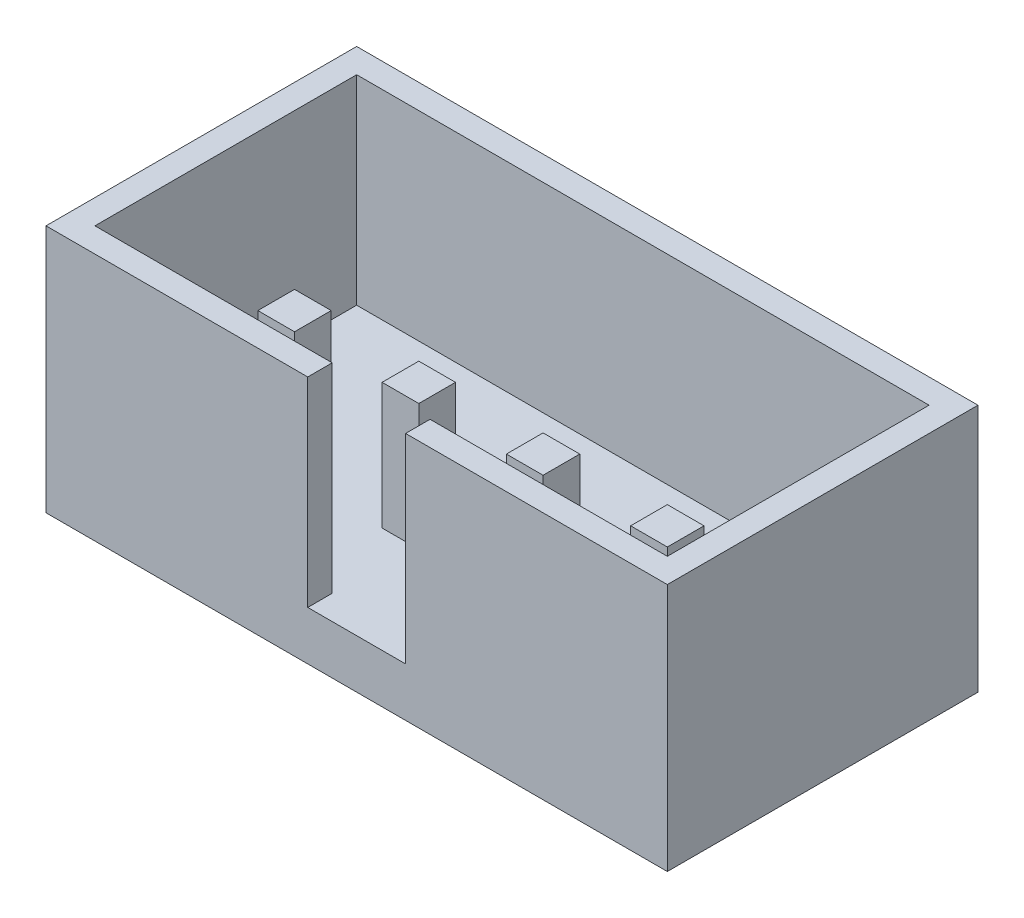
from build123d import *

# Parameters (mm, degrees)
SKETCH_1_W           = 12.7
SKETCH_1_H           = 6.35
EXTRUDE_1_DEPTH      = 5.08
SKETCH_2_W           = 11.7
SKETCH_2_H           = 5.35
CUT_EXTRUDE_1_DEPTH  = 4.08
SKETCH_3_W           = 2
SKETCH_3_H           = 4.08
CUT_EXTRUDE_2_DEPTH  = 1
EXTRUDE_2_DEPTH      = 2
EXTRUDE_2_DEPTH_BACK = 3.58
SKETCH_4_W           = 0.75
SKETCH_4_H           = 0.75


with BuildPart() as part:
    # 草图1 → 拉伸1 (new body)
    with BuildSketch(Plane(origin=(0, 0, 0), x_dir=(1, 0, 0), z_dir=(0, 1, 0))):
        Rectangle(SKETCH_1_W, SKETCH_1_H)
    extrude(amount=EXTRUDE_1_DEPTH)

    # 草图2 → 切除-拉伸1 (cut)
    with BuildSketch(Plane(origin=(0, 5.08, 0), x_dir=(-1, 0, 0), z_dir=(0, 1, 0))):
        Rectangle(SKETCH_2_W, SKETCH_2_H)
    extrude(amount=-CUT_EXTRUDE_1_DEPTH, mode=Mode.SUBTRACT)

    # 草图3 → 切除-拉伸2 (cut)
    with BuildSketch(Plane.XY.offset(3.175)):
        with Locations((0, 3.04)):
            Rectangle(SKETCH_3_W, SKETCH_3_H)
    extrude(amount=-CUT_EXTRUDE_2_DEPTH, mode=Mode.SUBTRACT)

    # 草图4 → 拉伸2 (add, two sides: drawn at the far end of the back side and taken through both)
    with BuildSketch(Plane.XZ.offset(-EXTRUDE_2_DEPTH_BACK)):
        with Locations((-1.27, 0.635)):
            Rectangle(SKETCH_4_W, SKETCH_4_H)
        with Locations((1.27, 0.635)):
            Rectangle(SKETCH_4_W, SKETCH_4_H)
        with Locations((3.81, 0.635)):
            Rectangle(SKETCH_4_W, SKETCH_4_H)
        with Locations((-3.81, 0.635)):
            Rectangle(SKETCH_4_W, SKETCH_4_H)
    extrude(amount=EXTRUDE_2_DEPTH + EXTRUDE_2_DEPTH_BACK)


solid = part.part
